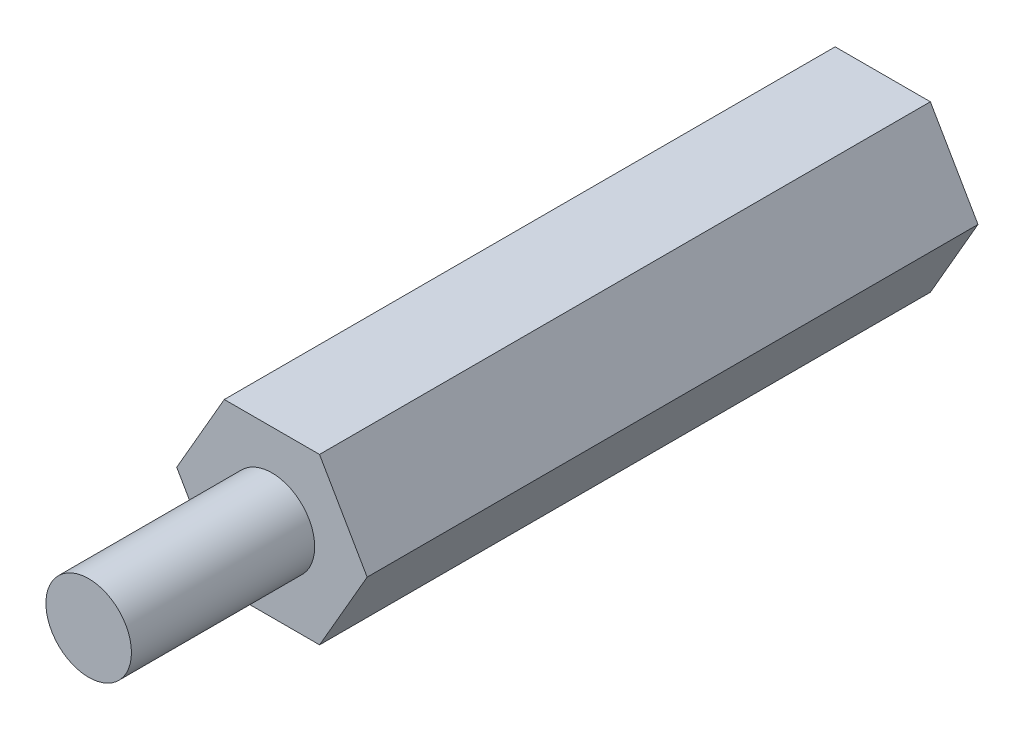
from build123d import *

# Parameters (mm, degrees)
ESQUISSE1_R        = 1.4
BOSS_EXTRU_1_DEPTH = 20
ESQUISSE2_R        = 1.4
BOSS_EXTRU_2_DEPTH = 6


with BuildPart() as part:
    # Esquisse1 → Boss.-Extru.1 (new body)
    with BuildSketch(Plane.XY):
        Polygon((-1.559711191, 2.699500139), (-3.117691293, -0.000999445), (-1.557980102, -2.700499584), (1.559711191, -2.699500139), (3.117691293, 0.000999445), (1.557980102, 2.700499584), align=None)
        Circle(ESQUISSE1_R, mode=Mode.SUBTRACT)
    extrude(amount=BOSS_EXTRU_1_DEPTH)


with BuildPart() as body_2:
    # Esquisse2 → Boss.-Extru.2 (new body)
    with BuildSketch(Plane.XY.offset(20)):
        Circle(ESQUISSE2_R)
    extrude(amount=BOSS_EXTRU_2_DEPTH)


solid = Compound([part.part, body_2.part])
